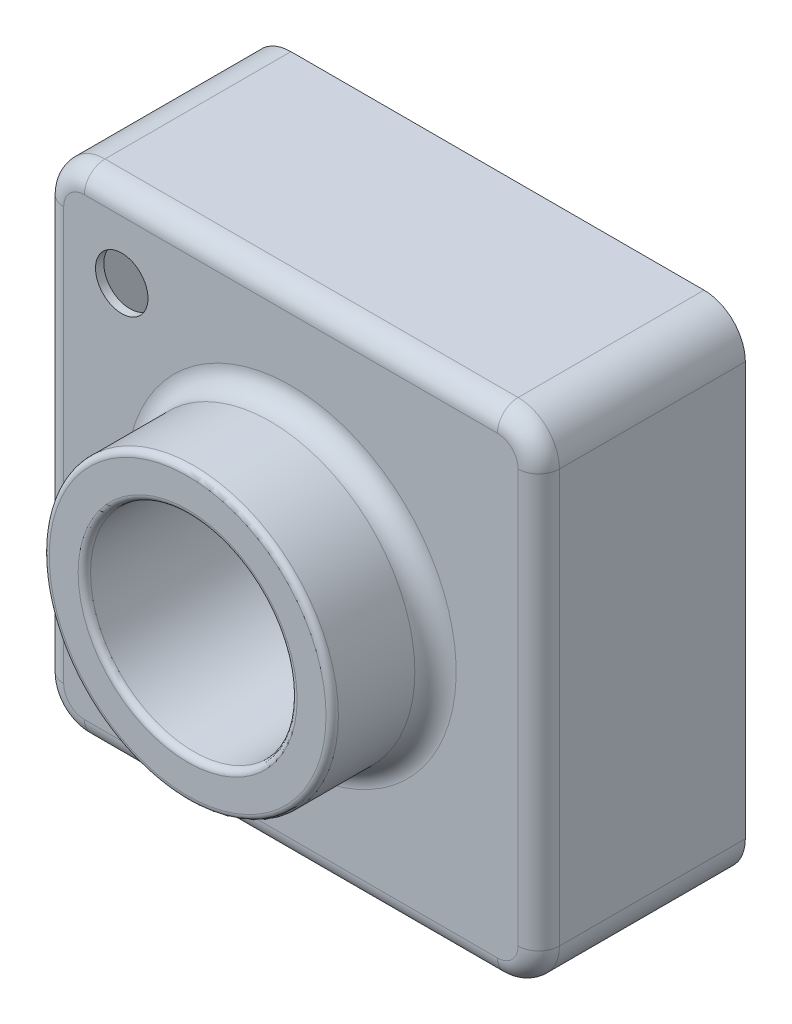
from build123d import *

# Parameters (mm, degrees)
SKETCH1_W           = 120
SKETCH1_H           = 120
BOSS_EXTRUDE1_DEPTH = 50
SKETCH3_R           = 35
BOSS_EXTRUDE2_DEPTH = 25
SKETCH6_R           = 25
CUT_EXTRUDE1_DEPTH  = 186.539753153
FILLET1_R           = 10
FILLET2_R           = 1.5
FILLET3_R           = 5
SHELL1_T            = -2
SKETCH7_R           = 6.35
CUT_EXTRUDE2_DEPTH  = 167.165552542


with BuildPart() as part:
    # Sketch1 → Boss-Extrude1 (new body)
    with BuildSketch(Plane.XY):
        with Locations((60, 60)):
            Rectangle(SKETCH1_W, SKETCH1_H)
    extrude(amount=BOSS_EXTRUDE1_DEPTH)

    # Sketch3 → Boss-Extrude2 (add)
    with BuildSketch(Plane.XY.offset(50)):
        with Locations((60, 60)):
            Circle(SKETCH3_R)
    extrude(amount=BOSS_EXTRUDE2_DEPTH)

    # Sketch6 → Cut-Extrude1 (cut, through all)
    with BuildSketch(Plane.XY.offset(75)):
        with Locations((60, 60)):
            Circle(SKETCH6_R)
    extrude(amount=-CUT_EXTRUDE1_DEPTH, mode=Mode.SUBTRACT)

    # Fillet1
    fillet1_edges = [part.edges().sort_by_distance(p)[0] for p in [
        (0, 120, 25),
        (120, 120, 25),
        (120, 0, 25),
        (0, 0, 25),
    ]]
    fillet(fillet1_edges, radius=FILLET1_R)

    # Fillet2
    fillet2_edges = [part.edges().sort_by_distance(p)[0] for p in [
        (25, 60, 75),
        (35, 60, 75),
    ]]
    fillet(fillet2_edges, radius=FILLET2_R)

    # Fillet3
    fillet3_edges = [part.edges().sort_by_distance(p)[0] for p in [
        (25, 60, 50),
        (0, 60, 50),
        (60, 120, 50),
        (60, 0, 50),
        (120, 60, 50),
        (117.071067812, 117.071067812, 50),
        (117.071067812, 2.928932188, 50),
        (2.928932188, 2.928932188, 50),
        (2.928932188, 117.071067812, 50),
    ]]
    fillet(fillet3_edges, radius=FILLET3_R)

    # Shell1
    shell1_openings = [part.faces().sort_by_distance(p)[0] for p in [
        (60, 1.697056275, 0),
    ]]
    offset(amount=SHELL1_T, openings=shell1_openings, kind=Kind.INTERSECTION)

    # Sketch7 → Cut-Extrude2 (cut, through all)
    with BuildSketch(Plane(origin=(92.802964226, -8.446878735, 50), x_dir=(1, 0, 0), z_dir=(0, 0, 1))):
        with Locations((-73.752964226, 109.396878735)):
            Circle(SKETCH7_R)
    extrude(amount=-CUT_EXTRUDE2_DEPTH, mode=Mode.SUBTRACT)


solid = part.part
